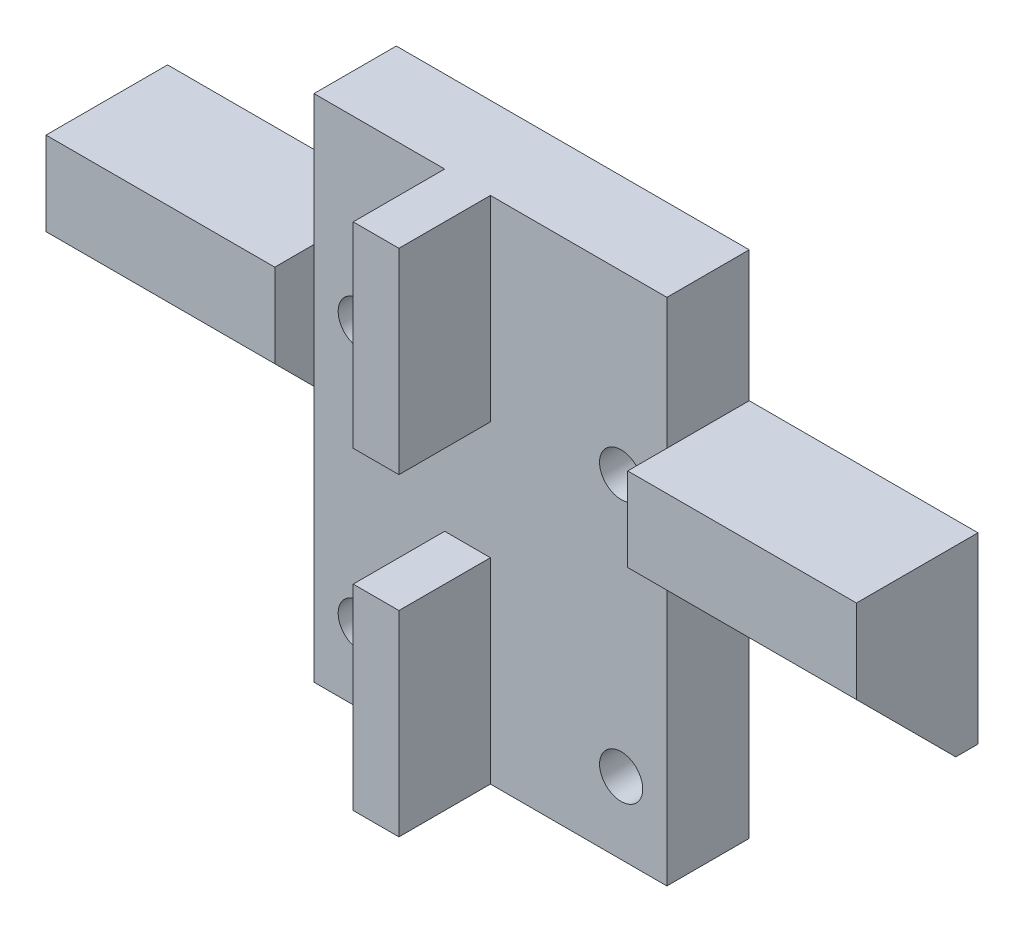
from build123d import *

# Parameters (mm, degrees)
SKETCH_1_R             = 1.65
EXTRUDE_512_DEPTH      = 13.3
CUT_EXTRUDE_925_DEPTH  = 7
SKETCH_3_W             = 17.5
SKETCH_3_H             = 14
CUT_EXTRUDE_1164_DEPTH = 4
CUT_EXTRUDE_R_DEPTH    = 17.5
CUT_EXTRUDE_L_DEPTH    = 17.5
SKETCH_6_R             = 2
CUT_EXTRUDE_5_DEPTH    = 3.5


with BuildPart() as part:
    # Эскиз1 → Extrude 512 (new body)
    with BuildSketch(Plane.XY):
        Polygon((-13.5, 23.5), (13.5, 23.5), (13.5, 13.5), (31, 13.5), (31, -0.5), (13.5, -0.5), (13.5, -15.5), (-13.5, -15.5), (-13.5, -0.5), (-31, -0.5), (-31, 13.5), (-13.5, 13.5), align=None)
        with Locations((-10, 10)):
            Circle(SKETCH_1_R, mode=Mode.SUBTRACT)
        with Locations((10, 10)):
            Circle(SKETCH_1_R, mode=Mode.SUBTRACT)
        with Locations((10, -10)):
            Circle(SKETCH_1_R, mode=Mode.SUBTRACT)
        with Locations((-10, -10)):
            Circle(SKETCH_1_R, mode=Mode.SUBTRACT)
    extrude(amount=EXTRUDE_512_DEPTH)

    # Эскиз2 → Cut-Extrude 925 (cut)
    with BuildSketch(Plane.XY.offset(13.3)):
        Polygon((0, 23.5), (13.5, 23.5), (13.5, -15.5), (0, -15.5), (0, -0.5), (-3.5, -0.5), (-3.5, -15.5), (-13.5, -15.5), (-13.5, 23.5), (-3.5, 23.5), (-3.5, 8.5), (0, 8.5), align=None)
    extrude(amount=-CUT_EXTRUDE_925_DEPTH, mode=Mode.SUBTRACT)

    # Эскиз3 → Cut-Extrude 1164 (cut)
    with BuildSketch(Plane.XY.offset(13.3)):
        with Locations((-22.25, 6.5)):
            Rectangle(SKETCH_3_W, SKETCH_3_H)
        with Locations((22.25, 6.5)):
            Rectangle(SKETCH_3_W, SKETCH_3_H)
    extrude(amount=-CUT_EXTRUDE_1164_DEPTH, mode=Mode.SUBTRACT)

    # Эскиз4 → СрезТягиR (cut)
    with BuildSketch(Plane(origin=(31, 0, 0), x_dir=(0, 0, -1), z_dir=(1, 0, 0))):
        Polygon((-9.3, 7.1), (-1.7, -0.5), (-9.3, -0.5), align=None)
    extrude(amount=-CUT_EXTRUDE_R_DEPTH, mode=Mode.SUBTRACT)

    # Эскиз5 → СрезТягиL (cut)
    with BuildSketch(Plane.ZY.offset(31)):
        Polygon((9.3, 7.1), (9.3, -0.5), (1.7, -0.5), align=None)
    extrude(amount=-CUT_EXTRUDE_L_DEPTH, mode=Mode.SUBTRACT)

    # Эскиз6 → Вырез-Вытянуть5 (cut)
    with BuildSketch(Plane(origin=(0, -1.1, 1.1), x_dir=(1, 0, 0), z_dir=(0, -0.7071067811865472, 0.7071067811865478))):
        with Locations(Location((-23.605, 9.348528137, 0), (0, 0, 270))):
            Circle(SKETCH_6_R)
        with Locations(Location((23.605, 9.348528137, 0), (0, 0, 270))):
            Circle(SKETCH_6_R)
    extrude(amount=-CUT_EXTRUDE_5_DEPTH, mode=Mode.SUBTRACT)


solid = part.part
